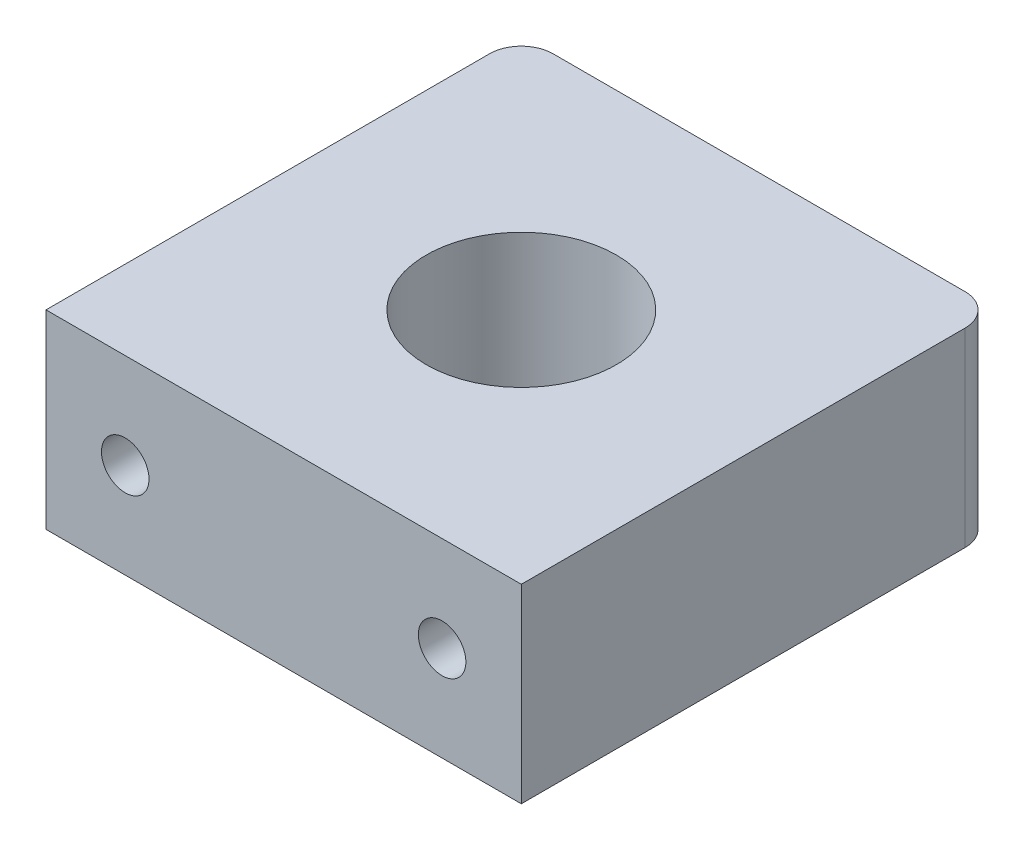
from build123d import *

# Parameters (mm, degrees)
SKETCH1_W           = 30
SKETCH1_H           = 30
SKETCH1_R           = 6
BOSS_EXTRUDE1_DEPTH = 12
FILLET1_R           = 2
SKETCH2_R           = 1.5
CUT_EXTRUDE1_DEPTH  = 5


with BuildPart() as part:
    # Sketch1 → Boss-Extrude1 (new body)
    with BuildSketch(Plane(origin=(0, 0, 0), x_dir=(1, 0, 0), z_dir=(0, 1, 0))):
        with Locations((15, 15)):
            Rectangle(SKETCH1_W, SKETCH1_H)
        with Locations(Location((15, 15, 0), (0, 0, 270))):
            Circle(SKETCH1_R, mode=Mode.SUBTRACT)
    extrude(amount=BOSS_EXTRUDE1_DEPTH)

    # Fillet1
    fillet1_edges = [part.edges().sort_by_distance(p)[0] for p in [
        (0, 6, -30),
        (30, 6, -30),
    ]]
    fillet(fillet1_edges, radius=FILLET1_R)

    # Sketch2 → Cut-Extrude1 (cut)
    with BuildSketch(Plane.XY):
        with Locations((5, 6)):
            Circle(SKETCH2_R)
        with Locations(Location((25, 6, 0), (0, 0, 180))):
            Circle(SKETCH2_R)
    extrude(amount=-CUT_EXTRUDE1_DEPTH, mode=Mode.SUBTRACT)


solid = part.part
